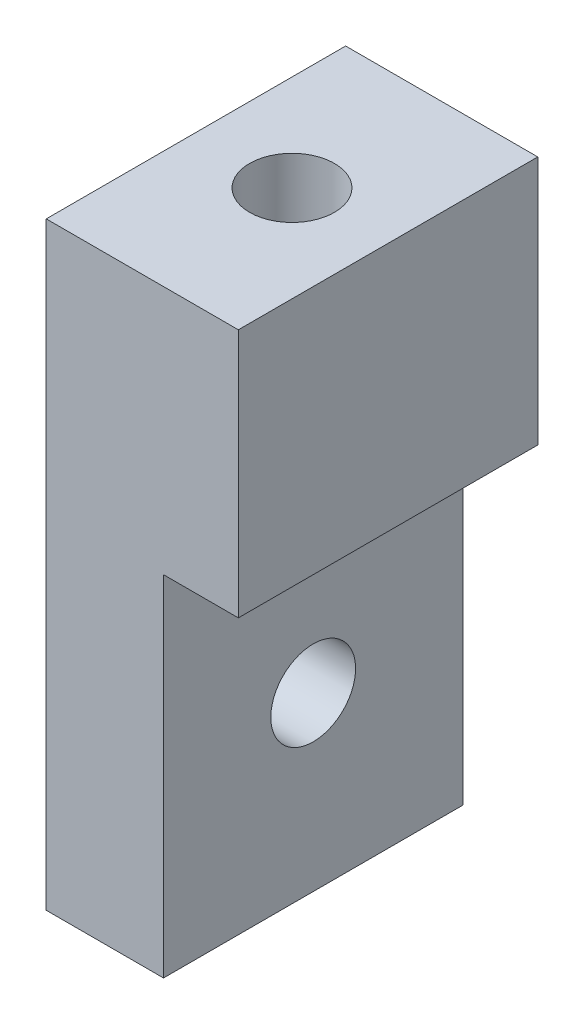
from build123d import *

# Parameters (mm, degrees)
BOSS_EXTRUDE1_DEPTH = 6
SKETCH2_R           = 0.85
CUT_EXTRUDE1_DEPTH  = 10.317859196
SKETCH3_R           = 0.85
CUT_EXTRUDE2_DEPTH  = 5


with BuildPart() as part:
    # Sketch1 → Boss-Extrude1 (new body)
    with BuildSketch(Plane.XY):
        Polygon((-1.925, -6), (0.425, -6), (0.425, 1), (1.925, 1), (1.925, 6), (-1.925, 6), align=None)
    extrude(amount=BOSS_EXTRUDE1_DEPTH)

    # Sketch2 → Cut-Extrude1 (cut, through all)
    with BuildSketch(Plane.ZY.offset(1.925)):
        with Locations(Location((3, -2.55134747, 0), (0, 0, 270))):
            Circle(SKETCH2_R)
    extrude(amount=-CUT_EXTRUDE1_DEPTH, mode=Mode.SUBTRACT)

    # Sketch3 → Cut-Extrude2 (cut)
    with BuildSketch(Plane(origin=(0, 6, 0), x_dir=(1, 0, 0), z_dir=(0, 1, 0))):
        with Locations(Location((0, -3, 0), (0, 0, 270))):
            Circle(SKETCH3_R)
    extrude(amount=-CUT_EXTRUDE2_DEPTH, mode=Mode.SUBTRACT)


solid = part.part
